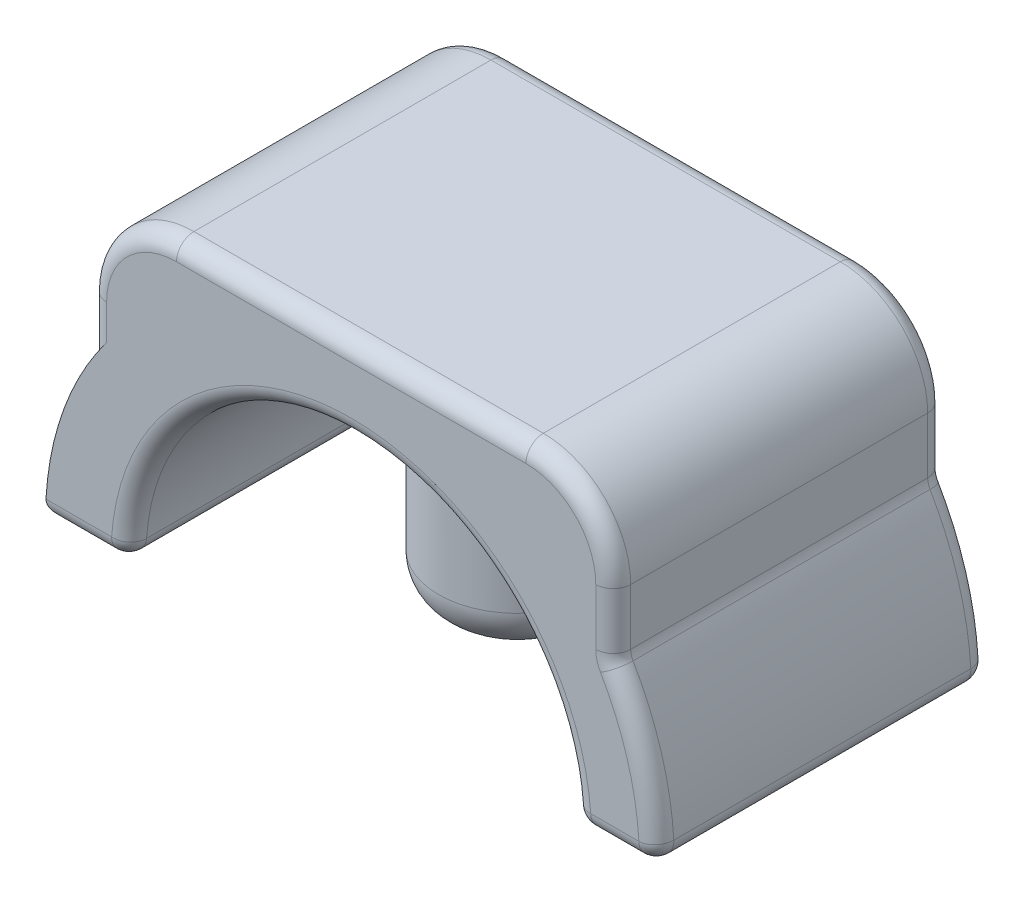
from build123d import *

# Parameters (mm, degrees)
BOSS_EXTRUDE1_DEPTH = 3.8
SKETCH3_R           = 0.9
BOSS_EXTRUDE2_DEPTH = 3
FILLET1_R           = 0.5
FILLET3_R           = 0.2


with BuildPart() as part:
    # Sketch2 → Boss-Extrude1 (new body)
    with BuildSketch(Plane.XY):
        with BuildLine():
            Line((-3.5, 0), (-2.55, 0))
            ThreePointArc((-2.55, 0), (0, 2.55), (2.55, 0))
            Line((2.55, 0), (3.5, 0))
            ThreePointArc((3.5, 0), (3.372684391, 0.935414347), (3, 1.802775638))
            Line((3, 1.802775638), (3, 2.5))
            ThreePointArc((3, 2.5), (2.707106781, 3.207106781), (2, 3.5))
            Line((2, 3.5), (0, 3.5))
            Line((0, 3.5), (-2, 3.5))
            ThreePointArc((-2, 3.5), (-2.707106781, 3.207106781), (-3, 2.5))
            Line((-3, 2.5), (-3, 1.802775638))
            ThreePointArc((-3, 1.802775638), (-3.372684391, 0.935414347), (-3.5, 0))
        make_face()
    extrude(amount=BOSS_EXTRUDE1_DEPTH)

    # Sketch3 → Boss-Extrude2 (add)
    with BuildSketch(Plane(origin=(0, 0, 0), x_dir=(1, 0, 0), z_dir=(0, 1, 0))):
        with Locations(Location((0, -1.9, 0), (0, 0, 90))):
            Circle(SKETCH3_R)
    extrude(amount=BOSS_EXTRUDE2_DEPTH)

    # Fillet1
    fillet1_edges = [part.edges().sort_by_distance(p)[0] for p in [
        (0, 0, 2.8),
    ]]
    fillet(fillet1_edges, radius=FILLET1_R)

    # Fillet3
    fillet3_edges = [part.edges().sort_by_distance(p)[0] for p in [
        (-3.025, 0, 3.8),
        (-3.025, 0, 0),
        (3.372684391, 0.935414347, 3.8),
        (3.372684391, 0.935414347, 0),
        (3.025, 0, 3.8),
        (3.5, 0, 1.9),
        (3.025, 0, 0),
        (0, 2.55, 2.8),
        (-2.55, 0, 1.9),
        (0, 2.55, 3.8),
        (2.55, 0, 1.9),
        (0, 2.55, 0),
        (-3, 2.151387819, 3.8),
        (-3, 2.151387819, 0),
        (-2.707106781, 3.207106781, 3.8),
        (-2.707106781, 3.207106781, 0),
        (0, 3.5, 3.8),
        (0, 3.5, 0),
        (2.707106781, 3.207106781, 3.8),
        (2.707106781, 3.207106781, 0),
        (3, 2.151387819, 3.8),
        (3, 2.151387819, 0),
        (-3.5, 0, 1.9),
        (3, 1.802775638, 1.9),
    ]]
    fillet(fillet3_edges, radius=FILLET3_R)


solid = part.part
